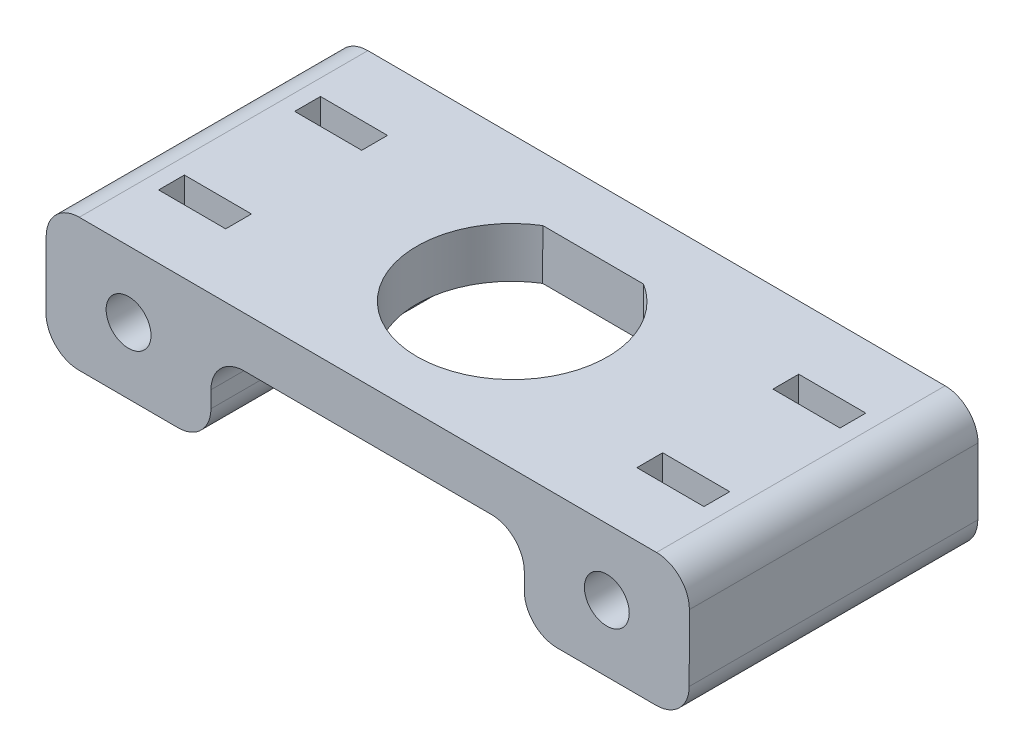
from build123d import *

# Parameters (mm, degrees)
BOSS_EXTRUDE1_DEPTH   = 22.225
CUT_EXTRUDE1_REACH    = 101.546
FILLET1_R             = 2.54
F_4_CLEARANCE_HOLE1_D = 3.4544
SKETCH6_W             = 5.1625
SKETCH6_H             = 1.9875
CUT_EXTRUDE2_DEPTH    = 8.255


with BuildPart() as part:
    # Sketch1 → Boss-Extrude1 (new body)
    with BuildSketch(Plane.XY):
        Polygon((-96.82388635, -119.84135975), (-47.294090685, -119.983632078), (-47.323432737, -130.198589936), (-60.023380343, -130.162109852), (-60.005140301, -123.812136049), (-84.135040753, -123.742823889), (-84.153280795, -130.092797692), (-96.853228402, -130.056317608), align=None)
    extrude(amount=BOSS_EXTRUDE1_DEPTH)

    # Sketch2 → Cut-Extrude1 (cut, up to next)
    with BuildSketch(Plane(origin=(-0.345035492, -120.118491334, 0), x_dir=(0.999995874513973, -0.0028724475686203272, 0), z_dir=(0.0028724475686203272, 0.999995874513973, 0)), mode=Mode.PRIVATE) as cut_extrude1_sk1:
        with BuildLine():
            Line((-67.837073069, -4.8775), (-75.591424695, -4.8775))
            ThreePointArc((-75.591424695, -4.8775), (-71.714248882, -18.4546875), (-67.837073069, -4.8775))
        make_face()
    cut_extrude1_tool1 = extrude(cut_extrude1_sk1.sketch, amount=-CUT_EXTRUDE1_REACH, mode=Mode.PRIVATE) & part.part
    add(cut_extrude1_tool1.solids().sort_by_distance((-72.058989, -119.912496, 11.350092))[0], mode=Mode.SUBTRACT)

    # Fillet1
    fillet1_edges = [part.edges().sort_by_distance(p)[0] for p in [
        (-96.82388635, -119.84135975, 11.1125),
        (-47.294090685, -119.983632078, 11.1125),
        (-47.323432737, -130.198589936, 11.1125),
        (-60.023380343, -130.162109852, 11.1125),
        (-60.005140301, -123.812136049, 11.1125),
        (-84.135040753, -123.742823889, 11.1125),
        (-84.153280795, -130.092797692, 11.1125),
        (-96.853228402, -130.056317608, 11.1125),
    ]]
    fillet(fillet1_edges, radius=FILLET1_R)

    # #4 Clearance Hole1 (through all)
    with Locations(Plane.XY.offset(22.225)):
        with Locations((-90.488583573, -124.967078721), (-53.658735514, -125.072870965)):
            Hole(F_4_CLEARANCE_HOLE1_D / 2)

    # Sketch6 → Cut-Extrude2 (cut)
    with BuildSketch(Plane(origin=(-0.345035492, -120.118491334, 0), x_dir=(0.999995874513973, -0.002872447568619416, 0), z_dir=(0.002872447568619416, 0.999995874513973, 0))):
        with Locations((-90.129248882, -16.35125)):
            Rectangle(SKETCH6_W, SKETCH6_H)
        with Locations((-90.129248882, -5.87375)):
            Rectangle(SKETCH6_W, SKETCH6_H)
        with Locations((-53.299248882, -5.87375)):
            Rectangle(SKETCH6_W, SKETCH6_H)
        with Locations((-53.299248882, -16.35125)):
            Rectangle(SKETCH6_W, SKETCH6_H)
    extrude(amount=-CUT_EXTRUDE2_DEPTH, mode=Mode.SUBTRACT)


solid = part.part
